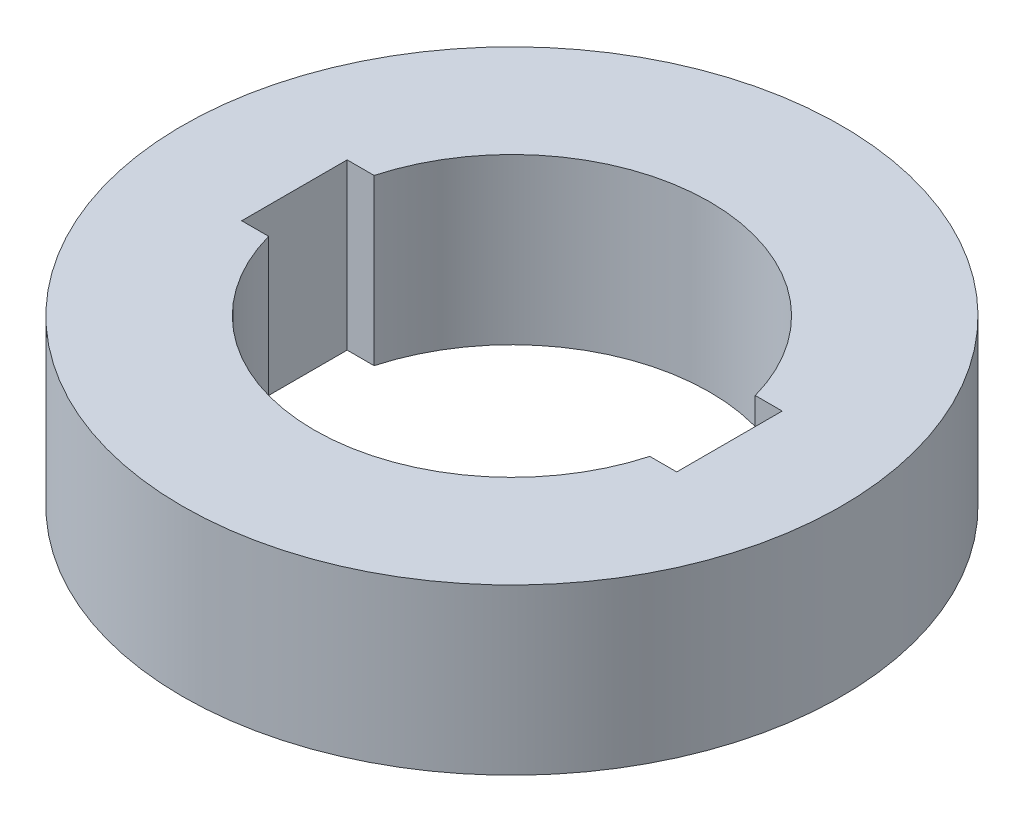
from build123d import *

# Parameters (mm, degrees)
SKETCH1_R           = 50
SKETCH1_R_2         = 30
BOSS_EXTRUDE1_DEPTH = 25
SKETCH2_W           = 66
SKETCH2_H           = 16
CUT_EXTRUDE1_DEPTH  = 76


with BuildPart() as part:
    # Sketch1 → Boss-Extrude1 (new body)
    with BuildSketch(Plane(origin=(0, 0, 0), x_dir=(1, 0, 0), z_dir=(0, 1, 0))):
        with Locations(Location((0, 0, 0), (0, 0, 270))):
            Circle(SKETCH1_R)
        with Locations(Location((0, 0, 0), (0, 0, 270))):
            Circle(SKETCH1_R_2, mode=Mode.SUBTRACT)
    extrude(amount=BOSS_EXTRUDE1_DEPTH)

    # Sketch2 → Cut-Extrude1 (cut, through all)
    with BuildSketch(Plane(origin=(0, 25, 0), x_dir=(1, 0, 0), z_dir=(0, 1, 0))):
        Rectangle(SKETCH2_W, SKETCH2_H)
    extrude(amount=-CUT_EXTRUDE1_DEPTH, mode=Mode.SUBTRACT)


solid = part.part
